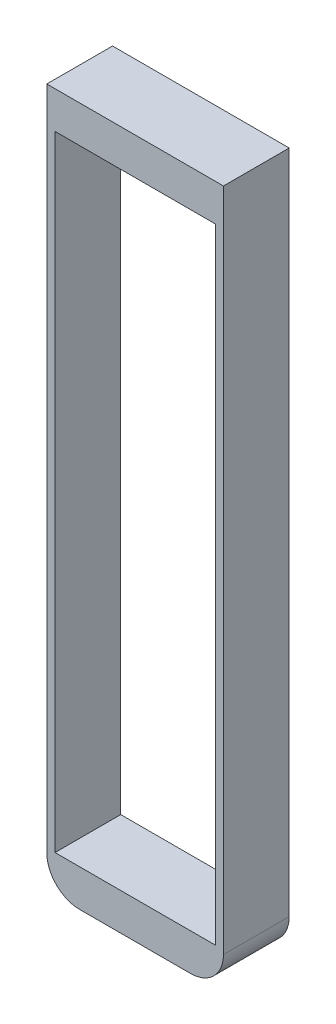
from build123d import *

# Parameters (mm, degrees)
SKETCH_1_W          = 43
SKETCH_1_H          = 170
EXTRUDE_1_DEPTH     = 16
SKETCH_3_W          = 39
SKETCH_3_H          = 152
CUT_EXTRUDE_1_DEPTH = 177.08236709
FILLET_3_R          = 8


with BuildPart() as part:
    # Эскиз1 → Бобышка-Вытянуть1 (new body)
    with BuildSketch(Plane.XY):
        with Locations((21.5, 85)):
            Rectangle(SKETCH_1_W, SKETCH_1_H)
    extrude(amount=EXTRUDE_1_DEPTH)

    # Эскиз3 → Вырез-Вытянуть1 (cut, through all)
    with BuildSketch(Plane.XY.offset(16)):
        with Locations((21.5, 85)):
            Rectangle(SKETCH_3_W, SKETCH_3_H)
    extrude(amount=-CUT_EXTRUDE_1_DEPTH, mode=Mode.SUBTRACT)

    # Скругление3
    fillet_3_edges = [part.edges().sort_by_distance(p)[0] for p in [
        (43, 0, 8),
        (0, 0, 8),
    ]]
    fillet(fillet_3_edges, radius=FILLET_3_R)


solid = part.part
